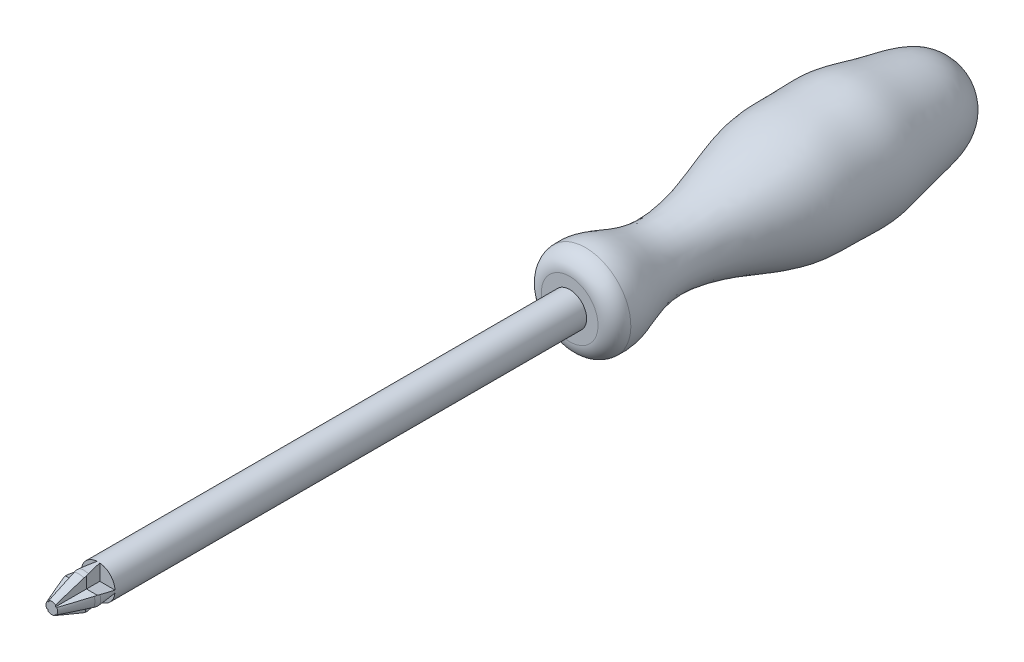
from build123d import *

# Parameters (mm, degrees)
SKETCH_2_R                         = 10
EXTRUDE_1_DEPTH                    = 271.27
FILLET_3_R                         = 8
SKETCH_5_W                         = 10.859894953
SKETCH_5_H                         = 11.233383404
CUT_EXTRUDE_1_DEPTH                = 17.32
CUT_EXTRUDE_1_DRAFT                = -3
PATTERN_CIRCULAR_2_COPY_1_SKETCH_W = 10.859894953
PATTERN_CIRCULAR_2_COPY_1_SKETCH_H = 11.233383404
PATTERN_CIRCULAR_2_COPY_1_DEPTH    = 17.32
PATTERN_CIRCULAR_2_COPY_1_DRAFT    = -3
PATTERN_CIRCULAR_2_COPY_2_SKETCH_W = 10.859894953
PATTERN_CIRCULAR_2_COPY_2_SKETCH_H = 11.233383404
PATTERN_CIRCULAR_2_COPY_2_DEPTH    = 17.32
PATTERN_CIRCULAR_2_COPY_2_DRAFT    = -3
PATTERN_CIRCULAR_2_COPY_3_SKETCH_W = 10.859894953
PATTERN_CIRCULAR_2_COPY_3_SKETCH_H = 11.233383404
PATTERN_CIRCULAR_2_COPY_3_DEPTH    = 17.32
PATTERN_CIRCULAR_2_COPY_3_DRAFT    = -3
CUT_EXTRUDE_2_DEPTH                = 10
CUT_EXTRUDE_2_DRAFT                = 12
PATTERN_CIRCULAR_3_COPY_1_DEPTH    = 10
PATTERN_CIRCULAR_3_COPY_1_DRAFT    = 12
PATTERN_CIRCULAR_3_COPY_2_DEPTH    = 10
PATTERN_CIRCULAR_3_COPY_2_DRAFT    = 12
PATTERN_CIRCULAR_3_COPY_3_DEPTH    = 10
PATTERN_CIRCULAR_3_COPY_3_DRAFT    = 12
FILLET_5_R                         = 10


with BuildPart() as part:
    # 草圖1 → 旋轉4 (revolve)
    with BuildSketch(Plane(origin=(0, 0, 0), x_dir=(0, 0, -1), z_dir=(1, 0, 0))):
        with BuildLine():
            Line((326.706438431, 93.11309328), (326.706438431, 67.808501611))
            Line((326.706438431, 67.808501611), (555.417397455, 67.808501611))
            add(Edge.make_bspline(
                [(555.417397455, 67.808501611), (557.371136433, 76.877475952), (548.259395822, 91.394449326), (527.503038108, 96.42628569), (510.063664495, 99.679693456), (491.891830625, 104.494760785), (472.677913547, 103.285537506), (446.044187709, 103.956473132), (412.615968251, 90.549430014), (374.181106978, 81.639494956), (346.339898079, 95.80621263), (332.80686857, 94.502643078), (326.706438431, 93.11309328)],
                knots=[0, 0, 0, 0, 0.077126679, 0.133119647, 0.18656754, 0.238110798, 0.300461991, 0.358626208, 0.475508553, 0.623438046, 0.69089072, 0.744475443, 0.744475443, 0.744475443, 0.744475443], degree=3))
        make_face()
    revolve(axis=Axis((0, 67.808501611, -555.417397455), (0, 0, 1)))

    # 草圖2 → 填料-伸長1 (add)
    with BuildSketch(Plane.XY.offset(-326.706438431)):
        with Locations((0, 67.808501611)):
            Circle(SKETCH_2_R)
    extrude(amount=EXTRUDE_1_DEPTH)

    # 草圖3 → 旋轉5 (revolve)
    with BuildSketch(Plane(origin=(0, 0, 0), x_dir=(0, 0, -1), z_dir=(1, 0, 0)), mode=Mode.PRIVATE) as revolve_5_sk:
        Polygon((55.436438431, 67.808501611), (20.776438431, 67.808501611), (20.776438431, 71.245033126), (38.096946507, 77.808501611), (55.436438431, 77.808501611), align=None)
    revolve(revolve_5_sk.sketch.rotate(Axis((0, 67.808501611, -55.436438431), (0, 0, 1)), 90), axis=Axis((0, 67.808501611, -55.436438431), (0, 0, 1)))

    # 圓角3
    fillet_3_edges = [part.edges().sort_by_distance(p)[0] for p in [
        (10, 67.808501611, -38.096946507),
    ]]
    fillet(fillet_3_edges, radius=FILLET_3_R)


with BuildPart() as cut_extrude_1_tool:
    # 草圖5 → 除料-伸長1 (with draft: the straight prism first)
    with BuildSketch(Plane.XY.offset(-20.776438431)):
        with Locations((7.673089972, 75.184655995)):
            Rectangle(SKETCH_5_W, SKETCH_5_H)
    extrude(amount=-CUT_EXTRUDE_1_DEPTH)
    # 除料-伸長1: the draft: its side faces are tilted about the plane it starts from
    cut_extrude_1_sides = [cut_extrude_1_tool.faces().sort_by_distance(p)[0] for p in [
        (7.673089973, 69.567964293, -29.436438431),
        (13.103037449, 75.184655995, -29.436438431),
        (7.673089973, 80.801347697, -29.436438431),
        (2.243142496, 75.184655995, -29.436438431),
    ]]
    draft(cut_extrude_1_sides, Plane.XY.offset(-20.776438431), CUT_EXTRUDE_1_DRAFT)


with BuildPart() as part_1:
    add(part.part)

    # 除料-伸長1: cut by cut_extrude_1_tool
    add(cut_extrude_1_tool.part, mode=Mode.SUBTRACT)


with BuildPart() as pattern_circular_2_copy_1_tool:
    # 環狀複製排列2 copy 1 sketch → 環狀複製排列2 copy 1 (with draft: the straight prism first)
    with BuildSketch(Plane(origin=(67.767454439, 67.812441965, -20.776438431), x_dir=(0, 1, 0), z_dir=(0, 0, 1))):
        with Locations((7.673089972, 75.184655995)):
            Rectangle(PATTERN_CIRCULAR_2_COPY_1_SKETCH_W, PATTERN_CIRCULAR_2_COPY_1_SKETCH_H)
    extrude(amount=-PATTERN_CIRCULAR_2_COPY_1_DEPTH)
    # 環狀複製排列2 copy 1: the draft: its side faces are tilted about the plane it starts from
    pattern_circular_2_copy_1_sides = [pattern_circular_2_copy_1_tool.faces().sort_by_distance(p)[0] for p in [
        (-1.800509854, 75.485531938, -29.436438431),
        (-7.417201556, 80.915479414, -29.436438431),
        (-13.033893258, 75.485531938, -29.436438431),
        (-7.417201556, 70.055584461, -29.436438431),
    ]]
    draft(pattern_circular_2_copy_1_sides, Plane(origin=(67.767454439, 67.812441965, -20.776438431), x_dir=(0, 1, 0), z_dir=(0, 0, 1)), PATTERN_CIRCULAR_2_COPY_1_DRAFT)


with BuildPart() as part_2:
    add(part_1.part)

    # 環狀複製排列2 copy 1: cut by pattern_circular_2_copy_1_tool
    add(pattern_circular_2_copy_1_tool.part, mode=Mode.SUBTRACT)


with BuildPart() as pattern_circular_2_copy_2_tool:
    # 環狀複製排列2 copy 2 sketch → 環狀複製排列2 copy 2 (with draft: the straight prism first)
    with BuildSketch(Plane(origin=(-0.044987526, 135.579896404, -20.776438431), x_dir=(-1, 0, 0), z_dir=(0, 0, 1))):
        with Locations((7.673089972, 75.184655995)):
            Rectangle(PATTERN_CIRCULAR_2_COPY_2_SKETCH_W, PATTERN_CIRCULAR_2_COPY_2_SKETCH_H)
    extrude(amount=-PATTERN_CIRCULAR_2_COPY_2_DEPTH)
    # 環狀複製排列2 copy 2: the draft: its side faces are tilted about the plane it starts from
    pattern_circular_2_copy_2_sides = [pattern_circular_2_copy_2_tool.faces().sort_by_distance(p)[0] for p in [
        (-7.718077499, 66.011932111, -29.436438431),
        (-13.148024975, 60.395240409, -29.436438431),
        (-7.718077499, 54.778548707, -29.436438431),
        (-2.288130022, 60.395240409, -29.436438431),
    ]]
    draft(pattern_circular_2_copy_2_sides, Plane(origin=(-0.044987526, 135.579896404, -20.776438431), x_dir=(-1, 0, 0), z_dir=(0, 0, 1)), PATTERN_CIRCULAR_2_COPY_2_DRAFT)


with BuildPart() as part_3:
    add(part_2.part)

    # 環狀複製排列2 copy 2: cut by pattern_circular_2_copy_2_tool
    add(pattern_circular_2_copy_2_tool.part, mode=Mode.SUBTRACT)


with BuildPart() as pattern_circular_2_copy_3_tool:
    # 環狀複製排列2 copy 3 sketch → 環狀複製排列2 copy 3 (with draft: the straight prism first)
    with BuildSketch(Plane(origin=(-67.812441965, 67.767454439, -20.776438431), x_dir=(0, -1, 0), z_dir=(0, 0, 1))):
        with Locations((7.673089972, 75.184655995)):
            Rectangle(PATTERN_CIRCULAR_2_COPY_3_SKETCH_W, PATTERN_CIRCULAR_2_COPY_3_SKETCH_H)
    extrude(amount=-PATTERN_CIRCULAR_2_COPY_3_DEPTH)
    # 環狀複製排列2 copy 3: the draft: its side faces are tilted about the plane it starts from
    pattern_circular_2_copy_3_sides = [pattern_circular_2_copy_3_tool.faces().sort_by_distance(p)[0] for p in [
        (1.755522328, 60.094364466, -29.436438431),
        (7.37221403, 54.66441699, -29.436438431),
        (12.988905732, 60.094364466, -29.436438431),
        (7.37221403, 65.524311943, -29.436438431),
    ]]
    draft(pattern_circular_2_copy_3_sides, Plane(origin=(-67.812441965, 67.767454439, -20.776438431), x_dir=(0, -1, 0), z_dir=(0, 0, 1)), PATTERN_CIRCULAR_2_COPY_3_DRAFT)


with BuildPart() as part_4:
    add(part_3.part)

    # 環狀複製排列2 copy 3: cut by pattern_circular_2_copy_3_tool
    add(pattern_circular_2_copy_3_tool.part, mode=Mode.SUBTRACT)


with BuildPart() as cut_extrude_2_tool:
    # 草圖6 → 除料-伸長2 (with draft: the straight prism first)
    with BuildSketch(Plane.XY.offset(-38.096438431)):
        Polygon((3.150845233, 70.47566703), (12.219984347, 70.47566703), (3.150845233, 79.544806144), align=None)
    extrude(amount=-CUT_EXTRUDE_2_DEPTH)
    # 除料-伸長2: the draft: its side faces are tilted about the plane it starts from
    cut_extrude_2_sides = [cut_extrude_2_tool.faces().sort_by_distance(p)[0] for p in [
        (7.68541479, 70.47566703, -43.096438431),
        (7.68541479, 75.010236587, -43.096438431),
        (3.150845233, 75.010236587, -43.096438431),
    ]]
    draft(cut_extrude_2_sides, Plane.XY.offset(-38.096438431), CUT_EXTRUDE_2_DRAFT)


with BuildPart() as part_5:
    add(part_4.part)

    # 除料-伸長2: cut by cut_extrude_2_tool
    add(cut_extrude_2_tool.part, mode=Mode.SUBTRACT)


with BuildPart() as pattern_circular_3_copy_1_tool:
    # 環狀複製排列3 copy 1 sketch → 環狀複製排列3 copy 1 (with draft: the straight prism first)
    with BuildSketch(Plane(origin=(67.801581631, 67.809165737, -38.096438431), x_dir=(0, 1, 0), z_dir=(0, 0, 1))):
        Polygon((3.150845233, 70.47566703), (12.219984347, 70.47566703), (3.150845233, 79.544806144), align=None)
    extrude(amount=-PATTERN_CIRCULAR_3_COPY_1_DEPTH)
    # 環狀複製排列3 copy 1: the draft: its side faces are tilted about the plane it starts from
    pattern_circular_3_copy_1_sides = [pattern_circular_3_copy_1_tool.faces().sort_by_distance(p)[0] for p in [
        (-2.674085399, 75.494580527, -43.096438431),
        (-7.208654956, 75.494580527, -43.096438431),
        (-7.208654956, 70.96001097, -43.096438431),
    ]]
    draft(pattern_circular_3_copy_1_sides, Plane(origin=(67.801581631, 67.809165737, -38.096438431), x_dir=(0, 1, 0), z_dir=(0, 0, 1)), PATTERN_CIRCULAR_3_COPY_1_DRAFT)


with BuildPart() as part_6:
    add(part_5.part)

    # 環狀複製排列3 copy 1: cut by pattern_circular_3_copy_1_tool
    add(pattern_circular_3_copy_1_tool.part, mode=Mode.SUBTRACT)


with BuildPart() as pattern_circular_3_copy_2_tool:
    # 環狀複製排列3 copy 2 sketch → 環狀複製排列3 copy 2 (with draft: the straight prism first)
    with BuildSketch(Plane(origin=(-0.007584106, 135.610747368, -38.096438431), x_dir=(-1, 0, 0), z_dir=(0, 0, 1))):
        Polygon((3.150845233, 70.47566703), (12.219984347, 70.47566703), (3.150845233, 79.544806144), align=None)
    extrude(amount=-PATTERN_CIRCULAR_3_COPY_2_DEPTH)
    # 環狀複製排列3 copy 2: the draft: its side faces are tilted about the plane it starts from
    pattern_circular_3_copy_2_sides = [pattern_circular_3_copy_2_tool.faces().sort_by_distance(p)[0] for p in [
        (-7.692998896, 65.135080338, -43.096438431),
        (-7.692998896, 60.600510781, -43.096438431),
        (-3.158429339, 60.600510781, -43.096438431),
    ]]
    draft(pattern_circular_3_copy_2_sides, Plane(origin=(-0.007584106, 135.610747368, -38.096438431), x_dir=(-1, 0, 0), z_dir=(0, 0, 1)), PATTERN_CIRCULAR_3_COPY_2_DRAFT)


with BuildPart() as part_7:
    add(part_6.part)

    # 環狀複製排列3 copy 2: cut by pattern_circular_3_copy_2_tool
    add(pattern_circular_3_copy_2_tool.part, mode=Mode.SUBTRACT)


with BuildPart() as pattern_circular_3_copy_3_tool:
    # 環狀複製排列3 copy 3 sketch → 環狀複製排列3 copy 3 (with draft: the straight prism first)
    with BuildSketch(Plane(origin=(-67.809165737, 67.801581631, -38.096438431), x_dir=(0, -1, 0), z_dir=(0, 0, 1))):
        Polygon((3.150845233, 70.47566703), (12.219984347, 70.47566703), (3.150845233, 79.544806144), align=None)
    extrude(amount=-PATTERN_CIRCULAR_3_COPY_3_DEPTH)
    # 環狀複製排列3 copy 3: the draft: its side faces are tilted about the plane it starts from
    pattern_circular_3_copy_3_sides = [pattern_circular_3_copy_3_tool.faces().sort_by_distance(p)[0] for p in [
        (2.666501293, 60.116166841, -43.096438431),
        (7.20107085, 60.116166841, -43.096438431),
        (7.20107085, 64.650736398, -43.096438431),
    ]]
    draft(pattern_circular_3_copy_3_sides, Plane(origin=(-67.809165737, 67.801581631, -38.096438431), x_dir=(0, -1, 0), z_dir=(0, 0, 1)), PATTERN_CIRCULAR_3_COPY_3_DRAFT)


with BuildPart() as part_8:
    add(part_7.part)

    # 環狀複製排列3 copy 3: cut by pattern_circular_3_copy_3_tool
    add(pattern_circular_3_copy_3_tool.part, mode=Mode.SUBTRACT)

    # 圓角5
    fillet_5_edges = [part_8.edges().sort_by_distance(p)[0] for p in [
        (0, 42.503909942, -326.706438431),
    ]]
    fillet(fillet_5_edges, radius=FILLET_5_R)


solid = part_8.part
